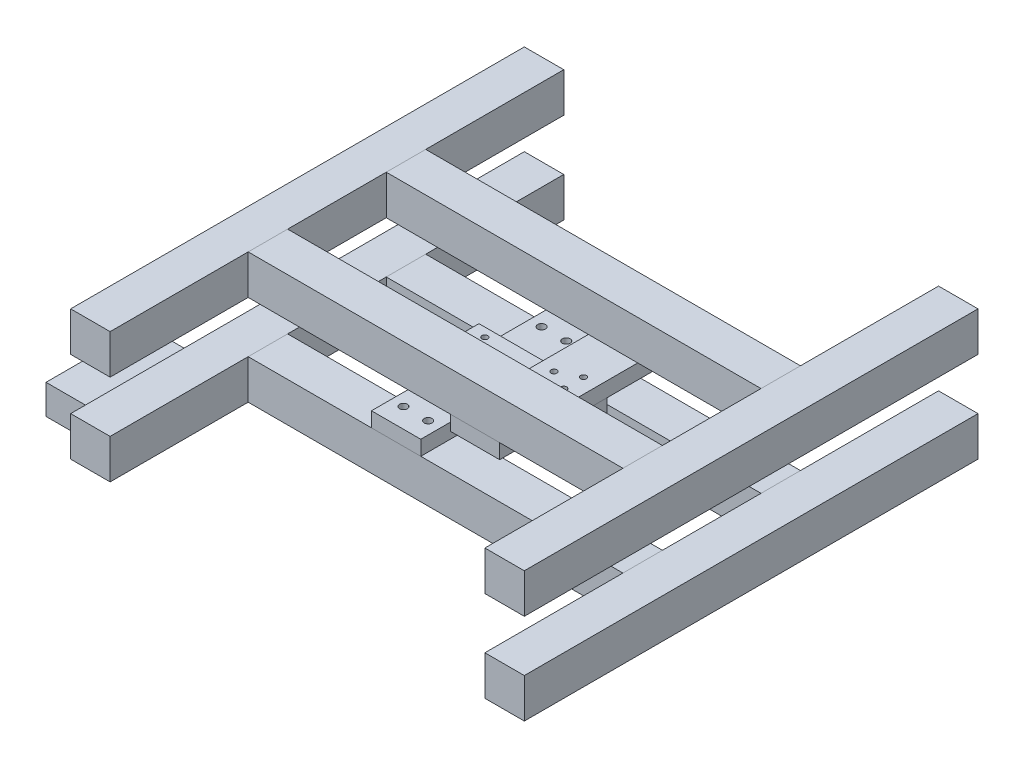
from build123d import *

# Parameters (mm, degrees)
SKETCH1_W             = 40
SKETCH1_H             = 40
BOSS_EXTRUDE1_DEPTH   = 460
SKETCH2_W             = 40
SKETCH2_H             = 40
BOSS_EXTRUDE2_DEPTH   = 380
BOSS_EXTRUDE2_2_DEPTH = 380
SKETCH3_W             = 40
SKETCH3_H             = 40
BOSS_EXTRUDE3_DEPTH   = 460
SKETCH4_W             = 50
SKETCH4_H             = 180
SKETCH4_R             = 4
SKETCH4_R_2           = 3
BOSS_EXTRUDE4_DEPTH   = 15
SKETCH5_W             = 38
SKETCH5_H             = 22
BOSS_EXTRUDE5_DEPTH   = 130
SKETCH6_R             = 3
CUT_EXTRUDE1_DEPTH    = 22
SKETCH7_W             = 50
SKETCH7_H             = 180
SKETCH7_R             = 3
SKETCH7_R_2           = 4
BOSS_EXTRUDE6_DEPTH   = 15
SKETCH8_W             = 40
SKETCH8_H             = 40
BOSS_EXTRUDE7_DEPTH   = 460
BOSS_EXTRUDE7_2_DEPTH = 460
SKETCH9_W             = 380
SKETCH9_H             = 40
BOSS_EXTRUDE8_DEPTH   = 40
BOSS_EXTRUDE8_2_DEPTH = 40
SKETCH11_W            = 50
SKETCH11_H            = 100
BOSS_EXTRUDE10_DEPTH  = 30


with BuildPart() as part:
    # Sketch1 → Boss-Extrude1 (new body)
    with BuildSketch(Plane.XY):
        with Locations((20, 20)):
            Rectangle(SKETCH1_W, SKETCH1_H)
    extrude(amount=BOSS_EXTRUDE1_DEPTH)


with BuildPart() as body_2:
    # Sketch2 → Boss-Extrude2 (new body)
    with BuildSketch(Plane(origin=(40, 0, 0), x_dir=(0, 0, -1), z_dir=(1, 0, 0))):
        with Locations((-300, 20)):
            Rectangle(SKETCH2_W, SKETCH2_H)
    extrude(amount=BOSS_EXTRUDE2_DEPTH)


with BuildPart() as body_3:
    # Sketch2 → Boss-Extrude2 2 (new body)
    with BuildSketch(Plane(origin=(40, 0, 0), x_dir=(0, 0, -1), z_dir=(1, 0, 0))):
        with Locations((-160, 20)):
            Rectangle(SKETCH2_W, SKETCH2_H)
    extrude(amount=BOSS_EXTRUDE2_2_DEPTH)


with BuildPart() as body_4:
    # Sketch3 → Boss-Extrude3 (new body)
    with BuildSketch(Plane.XY):
        with Locations((440, 20)):
            Rectangle(SKETCH3_W, SKETCH3_H)
    extrude(amount=BOSS_EXTRUDE3_DEPTH)


with BuildPart() as body_5:
    # Sketch4 → Boss-Extrude4 (new body)
    with BuildSketch(Plane(origin=(0, 40, 0), x_dir=(1, 0, 0), z_dir=(0, 1, 0))):
        with Locations((190, -230)):
            Rectangle(SKETCH4_W, SKETCH4_H)
        with Locations(Location((177.5, -160, 0), (0, 0, 270))):
            Circle(SKETCH4_R, mode=Mode.SUBTRACT)
        with Locations(Location((202.5, -160, 0), (0, 0, 270))):
            Circle(SKETCH4_R, mode=Mode.SUBTRACT)
        with Locations(Location((202.5, -300, 0), (0, 0, 270))):
            Circle(SKETCH4_R, mode=Mode.SUBTRACT)
        with Locations(Location((177.5, -300, 0), (0, 0, 90))):
            Circle(SKETCH4_R, mode=Mode.SUBTRACT)
        with Locations(Location((180, -220, 0), (0, 0, 270))):
            Circle(SKETCH4_R_2, mode=Mode.SUBTRACT)
        with Locations(Location((180, -240, 0), (0, 0, 270))):
            Circle(SKETCH4_R_2, mode=Mode.SUBTRACT)
        with Locations(Location((200, -230, 0), (0, 0, 270))):
            Circle(SKETCH4_R_2, mode=Mode.SUBTRACT)
    extrude(amount=BOSS_EXTRUDE4_DEPTH)


with BuildPart() as body_6:
    # Sketch5 → Boss-Extrude5 (new body)
    with BuildSketch(Plane.ZY.offset(-165)):
        with Locations((230, 66)):
            Rectangle(SKETCH5_W, SKETCH5_H)
    extrude(amount=-BOSS_EXTRUDE5_DEPTH)

    # Sketch6 → Cut-Extrude1 (cut)
    with BuildSketch(Plane(origin=(0, 77, 0), x_dir=(1, 0, 0), z_dir=(0, 1, 0))):
        with Locations(Location((280, -240, 0), (0, 0, 270))):
            Circle(SKETCH6_R)
        with Locations(Location((260, -230, 0), (0, 0, 270))):
            Circle(SKETCH6_R)
        with Locations(Location((280, -220, 0), (0, 0, 270))):
            Circle(SKETCH6_R)
        with Locations(Location((180, -240, 0), (0, 0, 90))):
            Circle(SKETCH6_R)
        with Locations(Location((180, -220, 0), (0, 0, 90))):
            Circle(SKETCH6_R)
        with Locations(Location((200, -230, 0), (0, 0, 90))):
            Circle(SKETCH6_R)
    extrude(amount=-CUT_EXTRUDE1_DEPTH, mode=Mode.SUBTRACT)


with BuildPart() as body_7:
    # Sketch7 → Boss-Extrude6 (new body)
    with BuildSketch(Plane(origin=(0, 77, 0), x_dir=(1, 0, 0), z_dir=(0, 1, 0))):
        with Locations((270, -230)):
            Rectangle(SKETCH7_W, SKETCH7_H)
        with Locations(Location((260, -230, 0), (0, 0, 270))):
            Circle(SKETCH7_R, mode=Mode.SUBTRACT)
        with Locations(Location((280, -220, 0), (0, 0, 270))):
            Circle(SKETCH7_R, mode=Mode.SUBTRACT)
        with Locations(Location((280, -240, 0), (0, 0, 270))):
            Circle(SKETCH7_R, mode=Mode.SUBTRACT)
        with Locations(Location((257.5, -160, 0), (0, 0, 270))):
            Circle(SKETCH7_R_2, mode=Mode.SUBTRACT)
        with Locations(Location((282.5, -160, 0), (0, 0, 270))):
            Circle(SKETCH7_R_2, mode=Mode.SUBTRACT)
        with Locations(Location((282.5, -300, 0), (0, 0, 90))):
            Circle(SKETCH7_R_2, mode=Mode.SUBTRACT)
        with Locations(Location((257.5, -300, 0), (0, 0, 90))):
            Circle(SKETCH7_R_2, mode=Mode.SUBTRACT)
    extrude(amount=BOSS_EXTRUDE6_DEPTH)


with BuildPart() as body_8:
    # Sketch8 → Boss-Extrude7 (new body)
    with BuildSketch(Plane.XY):
        with Locations((440, 112)):
            Rectangle(SKETCH8_W, SKETCH8_H)
    extrude(amount=BOSS_EXTRUDE7_DEPTH)


with BuildPart() as body_9:
    # Sketch8 → Boss-Extrude7 2 (new body)
    with BuildSketch(Plane.XY):
        with Locations((20, 112)):
            Rectangle(SKETCH8_W, SKETCH8_H)
    extrude(amount=BOSS_EXTRUDE7_2_DEPTH)


with BuildPart() as body_10:
    # Sketch9 → Boss-Extrude8 (new body)
    with BuildSketch(Plane(origin=(0, 132, 0), x_dir=(1, 0, 0), z_dir=(0, 1, 0))):
        with Locations((230, -160)):
            Rectangle(SKETCH9_W, SKETCH9_H)
    extrude(amount=-BOSS_EXTRUDE8_DEPTH)


with BuildPart() as body_11:
    # Sketch9 → Boss-Extrude8 2 (new body)
    with BuildSketch(Plane(origin=(0, 132, 0), x_dir=(1, 0, 0), z_dir=(0, 1, 0))):
        with Locations((230, -300)):
            Rectangle(SKETCH9_W, SKETCH9_H)
    extrude(amount=-BOSS_EXTRUDE8_2_DEPTH)


with BuildPart() as body_12:
    # Sketch11 → Boss-Extrude10 (new body)
    with BuildSketch(Plane(origin=(0, 0, 0), x_dir=(-1, 0, 0), z_dir=(0, -1, 0))):
        with Locations((25, -385)):
            Rectangle(SKETCH11_W, SKETCH11_H)
    extrude(amount=-BOSS_EXTRUDE10_DEPTH)


solid = Compound([part.part, body_2.part, body_3.part, body_4.part, body_5.part, body_6.part, body_7.part, body_8.part, body_9.part, body_10.part, body_11.part, body_12.part])
